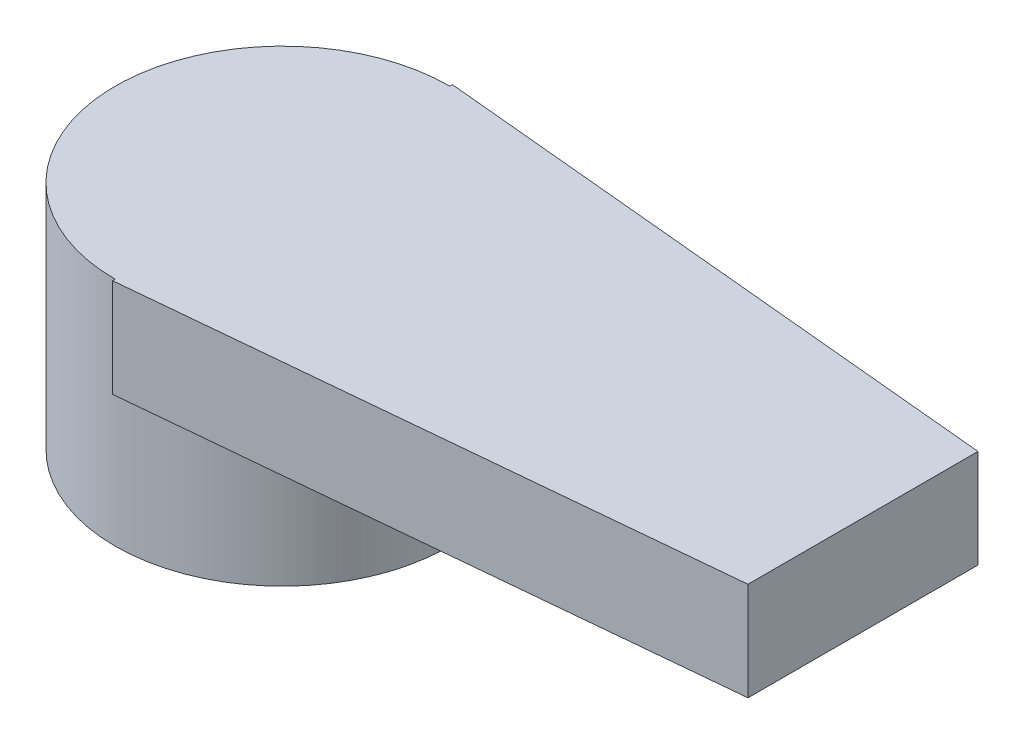
from build123d import *

# Parameters (mm, degrees)
BOSS_EXTRUDE1_START = 19.3
SKETCH1_R           = 3.4
BOSS_EXTRUDE1_DEPTH = 2.35
BOSS_EXTRUDE2_START = 20.65
BOSS_EXTRUDE2_DEPTH = 1
CUT_EXTRUDE1_START  = 18.3
SKETCH3_R           = 2.45
CUT_EXTRUDE1_DEPTH  = 1.35


with BuildPart() as part:
    # Sketch1 → Boss-Extrude1 (new, symmetric)
    with BuildSketch(Plane(origin=(0, 0, 0), x_dir=(1, 0, 0), z_dir=(0, 1, 0)).offset(BOSS_EXTRUDE1_START)):
        with Locations(Location((0, 0, 0), (0, 0, 90))):
            Circle(SKETCH1_R)
    extrude(amount=BOSS_EXTRUDE1_DEPTH, both=True)

    # Sketch2 → Boss-Extrude2 (add, symmetric)
    with BuildSketch(Plane(origin=(0, 0, 0), x_dir=(1, 0, 0), z_dir=(0, 1, 0)).offset(BOSS_EXTRUDE2_START)):
        Polygon((0, 3.453116188), (11.8, 2.337687781), (11.8, -2.337687781), (0, -3.453116188), align=None)
    extrude(amount=BOSS_EXTRUDE2_DEPTH, both=True)

    # Sketch3 → Cut-Extrude1 (cut, symmetric)
    with BuildSketch(Plane(origin=(0, 0, 0), x_dir=(1, 0, 0), z_dir=(0, 1, 0)).offset(CUT_EXTRUDE1_START)):
        with Locations(Location((0, 0, 0), (0, 0, 270))):
            Circle(SKETCH3_R)
    extrude(amount=CUT_EXTRUDE1_DEPTH, both=True, mode=Mode.SUBTRACT)


solid = part.part
